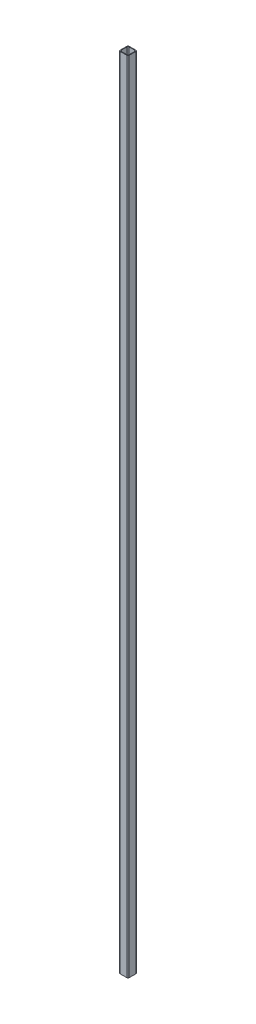
from build123d import *

# Parameters (mm, degrees)
BOSS_EXTRUDE1_DEPTH = 715


with BuildPart() as part:
    # Sketch1 → Boss-Extrude1 (new body)
    with BuildSketch(Plane(origin=(0, 0, 0), x_dir=(1, 0, 0), z_dir=(0, 1, 0))):
        with BuildLine():
            Line((-3, -4), (3, -4))
            ThreePointArc((3, -4), (3.707106781, -3.707106781), (4, -3))
            Line((4, -3), (4, 3))
            ThreePointArc((4, 3), (3.707106781, 3.707106781), (3, 4))
            Line((3, 4), (-3, 4))
            ThreePointArc((-3, 4), (-3.707106781, 3.707106781), (-4, 3))
            Line((-4, 3), (-4, -3))
            ThreePointArc((-4, -3), (-3.707106781, -3.707106781), (-3, -4))
        make_face()
        with BuildLine():
            Line((-2.5, -3.5), (2.5, -3.5))
            ThreePointArc((2.5, -3.5), (3.207106781, -3.207106781), (3.5, -2.5))
            Line((3.5, -2.5), (3.5, 2.5))
            ThreePointArc((3.5, 2.5), (3.207106781, 3.207106781), (2.5, 3.5))
            Line((2.5, 3.5), (-2.5, 3.5))
            ThreePointArc((-2.5, 3.5), (-3.207106781, 3.207106781), (-3.5, 2.5))
            Line((-3.5, 2.5), (-3.5, -2.5))
            ThreePointArc((-3.5, -2.5), (-3.207106781, -3.207106781), (-2.5, -3.5))
        make_face(mode=Mode.SUBTRACT)
    extrude(amount=BOSS_EXTRUDE1_DEPTH)


solid = part.part
